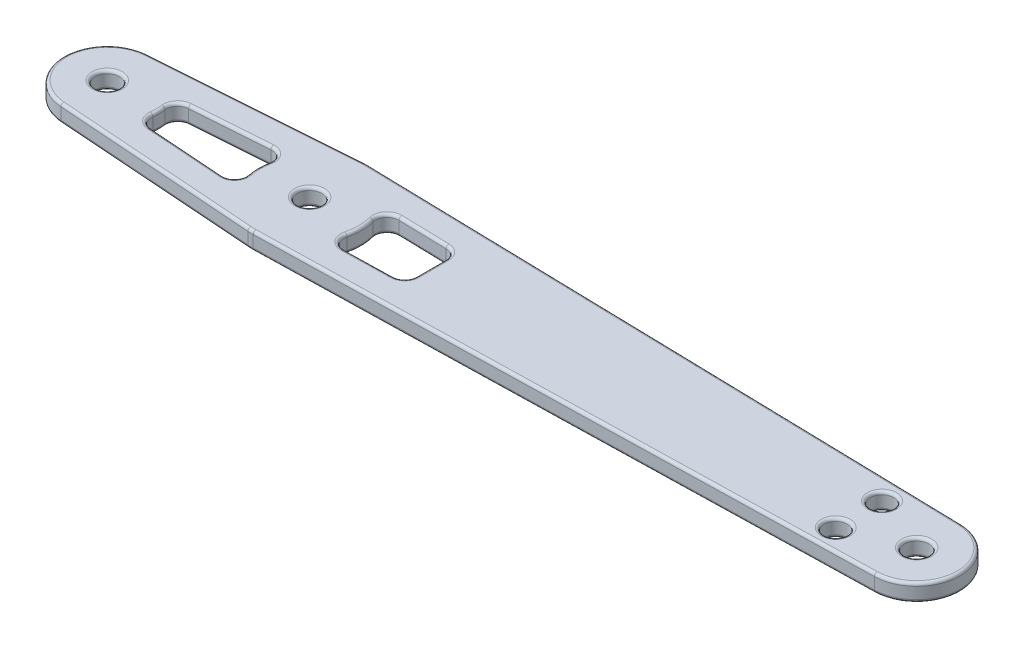
from build123d import *

# Parameters (mm, degrees)
SKETCH1_R           = 2.1
BOSS_EXTRUDE1_DEPTH = 3
CUT_EXTRUDE1_DEPTH  = 6
SKETCH5_R           = 2
CUT_EXTRUDE2_DEPTH  = 148.869029888
FILLET1_R           = 0.5


with BuildPart() as part:
    # Sketch1 → Boss-Extrude1 (new body)
    with BuildSketch(Plane(origin=(0, 0, 0), x_dir=(1, 0, 0), z_dir=(0, 1, 0))):
        with BuildLine():
            Line((-0.535714286, 7.480842881), (34.285714286, 9.974457174))
            ThreePointArc((34.285714286, 9.974457174), (34.761634199, 9.997158684), (35.238095238, 9.997165131))
            Line((35.238095238, 9.997165131), (140.178571429, 7.497873848))
            ThreePointArc((140.178571429, 7.497873848), (147.5, 0), (140.178571429, -7.497873848))
            Line((140.178571429, -7.497873848), (35.238095238, -9.997165131))
            ThreePointArc((35.238095238, -9.997165131), (34.761634199, -9.997158684), (34.285714286, -9.974457174))
            Line((34.285714286, -9.974457174), (-0.535714286, -7.480842881))
            ThreePointArc((-0.535714286, -7.480842881), (-7.5, 0), (-0.535714286, 7.480842881))
        make_face()
        with Locations(Location((0, 0, 0), (0, 0, 270))):
            Circle(SKETCH1_R, mode=Mode.SUBTRACT)
        with Locations(Location((35, 0, 0), (0, 0, 270))):
            Circle(SKETCH1_R, mode=Mode.SUBTRACT)
        with Locations(Location((140, 0, 0), (0, 0, 270))):
            Circle(SKETCH1_R, mode=Mode.SUBTRACT)
    extrude(amount=BOSS_EXTRUDE1_DEPTH)

    # Sketch3 → Cut-Extrude1 (cut)
    with BuildSketch(Plane.XZ):
        with BuildLine():
            Line((10.781990992, 3.278516471), (24.086883885, 4.231299641))
            ThreePointArc((24.086883885, 4.231299641), (25.734967774, 3.55333358), (26.187969932, 1.829788532))
            ThreePointArc((26.187969932, 1.829788532), (26, 0), (26.187969932, -1.829788532))
            ThreePointArc((26.187969932, -1.829788532), (25.734967774, -3.55333358), (24.086883885, -4.231299641))
            Line((24.086883885, -4.231299641), (10.781990992, -3.278516471))
            ThreePointArc((10.781990992, -3.278516471), (9.383851256, -2.558508804), (8.93851211, -1.050238666))
            ThreePointArc((8.93851211, -1.050238666), (9, 0), (8.93851211, 1.050238666))
            ThreePointArc((8.93851211, 1.050238666), (9.383851256, 2.558508804), (10.781990992, 3.278516471))
        make_face()
        with BuildLine():
            Line((45.69905272, 4.74660625), (54.047619048, 4.547774495))
            ThreePointArc((54.047619048, 4.547774495), (55.4309504, 3.945617731), (56, 2.548341469))
            Line((56, 2.548341469), (56, -2.548341469))
            ThreePointArc((56, -2.548341469), (55.4309504, -3.945617731), (54.047619048, -4.547774495))
            Line((54.047619048, -4.547774495), (45.69905272, -4.74660625))
            ThreePointArc((45.69905272, -4.74660625), (44.085153257, -3.990863563), (43.714809368, -2.247687183))
            ThreePointArc((43.714809368, -2.247687183), (44, 0), (43.714809368, 2.247687183))
            ThreePointArc((43.714809368, 2.247687183), (44.085153257, 3.990863563), (45.69905272, 4.74660625))
        make_face()
    extrude(amount=-CUT_EXTRUDE1_DEPTH, mode=Mode.SUBTRACT)

    # Sketch5 → Cut-Extrude2 (cut, through all)
    with BuildSketch(Plane.XZ):
        with Locations(Location((130, 4, 0), (0, 0, 270))):
            Circle(SKETCH5_R)
        with Locations(Location((130, -4, 0), (0, 0, 90))):
            Circle(SKETCH5_R)
    extrude(amount=-CUT_EXTRUDE2_DEPTH, mode=Mode.SUBTRACT)

    # Fillet1
    fillet1_edges = [part.edges().sort_by_distance(p)[0] for p in [
        (147.5, 3, 0),
        (87.708333333, 0, 8.74751949),
        (34.761634199, 0, 9.997158684),
        (130, 3, 6),
        (130, 0, 6),
        (130, 3, -6),
        (130, 0, -6),
        (87.708333333, 3, -8.74751949),
        (34.761634199, 3, -9.997158684),
        (16.875, 3, -8.727650027),
        (0, 0, -2.1),
        (0, 3, -2.1),
        (-7.5, 3, 0),
        (35, 0, -2.1),
        (35, 3, -2.1),
        (16.875, 3, 8.727650027),
        (140, 0, -2.1),
        (140, 3, -2.1),
        (34.761634199, 3, 9.997158684),
        (9.383851256, 3, 2.558508804),
        (17.434437438, 3, 3.754908056),
        (25.734967774, 3, 3.55333358),
        (26, 3, 0),
        (25.734967774, 3, -3.55333358),
        (17.434437438, 3, -3.754908056),
        (9.383851256, 3, -2.558508804),
        (9, 3, 0),
        (9.383851256, 0, 2.558508804),
        (9, 0, 0),
        (9.383851256, 0, -2.558508804),
        (17.434437438, 0, -3.754908056),
        (25.734967774, 0, -3.55333358),
        (26, 0, 0),
        (25.734967774, 0, 3.55333358),
        (17.434437438, 0, 3.754908056),
        (87.708333333, 3, 8.74751949),
        (44.085153257, 3, 3.990863563),
        (49.873335884, 3, 4.647190373),
        (55.4309504, 3, 3.945617731),
        (56, 3, 0),
        (55.4309504, 3, -3.945617731),
        (16.875, 0, 8.727650027),
        (49.873335884, 3, -4.647190373),
        (44.085153257, 3, -3.990863563),
        (44, 3, 0),
        (44.085153257, 0, 3.990863563),
        (44, 0, 0),
        (44.085153257, 0, -3.990863563),
        (49.873335884, 0, -4.647190373),
        (55.4309504, 0, -3.945617731),
        (56, 0, 0),
        (-7.5, 0, 0),
        (55.4309504, 0, 3.945617731),
        (49.873335884, 0, 4.647190373),
        (16.875, 0, -8.727650027),
        (34.761634199, 0, -9.997158684),
        (87.708333333, 0, -8.74751949),
        (147.5, 0, 0),
    ]]
    fillet(fillet1_edges, radius=FILLET1_R)


solid = part.part
